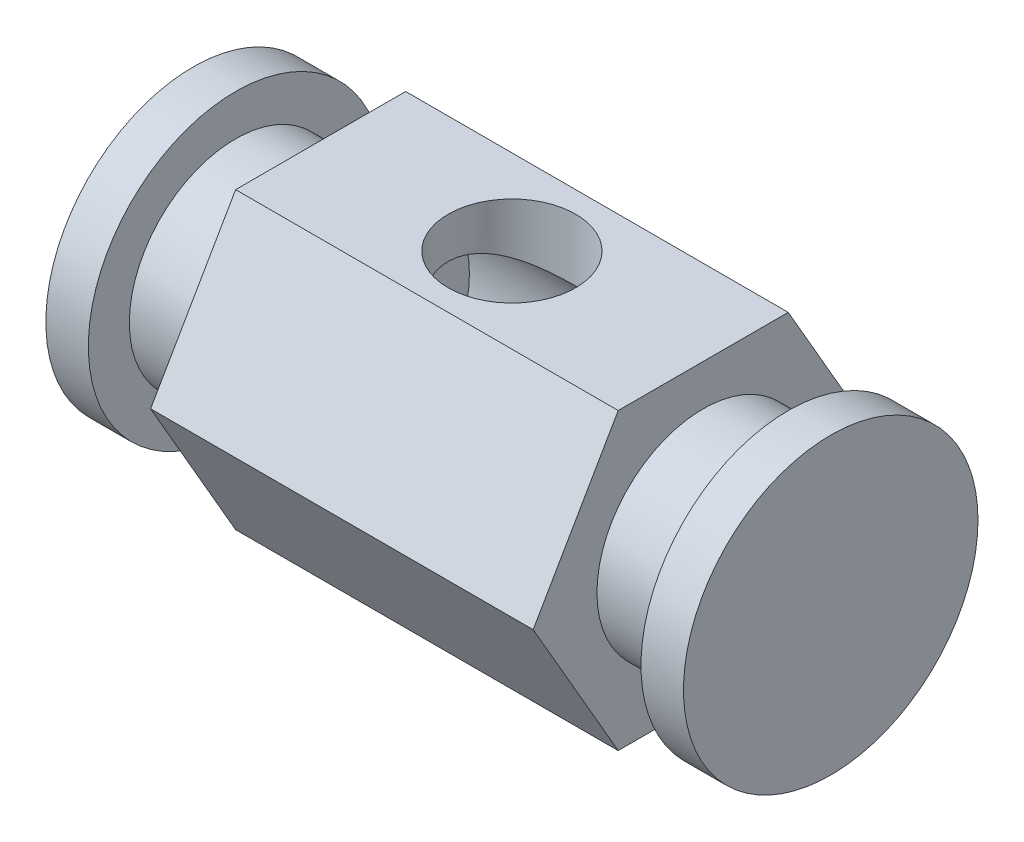
from build123d import *

# Parameters (mm, degrees)
SKETCH1_R               = 12.5
BOSS_EXTRUDE1_DEPTH     = 22.5
CUT_EXTRUDE2_DEPTH      = 35.731109974
CUT_EXTRUDE2_DEPTH_BACK = 35.731109974
SKETCH2_R               = 7.5
BOSS_EXTRUDE2_START     = -5
SKETCH3_R               = 12.5
BOSS_EXTRUDE2_DEPTH     = 15
SKETCH4_R               = 17.320508076
BOSS_EXTRUDE3_DEPTH     = 5


with BuildPart() as part:
    # Sketch1 → Boss-Extrude1 (new, symmetric)
    with BuildSketch(Plane(origin=(0, 0, 0), x_dir=(0, 0, -1), z_dir=(1, 0, 0))):
        Polygon((10, 17.320508076), (-10, 17.320508076), (-20, 0), (-10, -17.320508076), (10, -17.320508076), (20, 0), align=None)
        with Locations(Location((0, 0, 0), (0, 0, 180))):
            Circle(SKETCH1_R, mode=Mode.SUBTRACT)
    extrude(amount=BOSS_EXTRUDE1_DEPTH, both=True)

    # Sketch2 → Cut-Extrude2 (cut, two sides: drawn at the far end of the back side and taken through both)
    with BuildSketch(Plane(origin=(0, 0, 0), x_dir=(1, 0, 0), z_dir=(0, 1, 0)).offset(-CUT_EXTRUDE2_DEPTH_BACK)):
        with Locations(Location((0, 0, 0), (0, 0, 270))):
            Circle(SKETCH2_R)
    extrude(amount=CUT_EXTRUDE2_DEPTH + CUT_EXTRUDE2_DEPTH_BACK, mode=Mode.SUBTRACT)

    # Sketch3 → Boss-Extrude2 (add)
    with BuildSketch(Plane(origin=(22.5, 0, 0), x_dir=(0, 0, -1), z_dir=(1, 0, 0)).offset(BOSS_EXTRUDE2_START)):
        Circle(SKETCH3_R)
    boss_extrude2 = extrude(amount=BOSS_EXTRUDE2_DEPTH)

    # Sketch4 → Boss-Extrude3 (add)
    with BuildSketch(Plane(origin=(32.5, 0, 0), x_dir=(0, 0, -1), z_dir=(1, 0, 0))):
        Circle(SKETCH4_R)
    boss_extrude3 = extrude(amount=BOSS_EXTRUDE3_DEPTH)

    # Mirror3: Boss-Extrude2, Boss-Extrude3 across plane
    add(boss_extrude2.mirror(Plane(origin=(0, 0, 0), x_dir=(0, 0, 1), z_dir=(1, 0, 0))))
    add(boss_extrude3.mirror(Plane(origin=(0, 0, 0), x_dir=(0, 0, 1), z_dir=(1, 0, 0))))


solid = part.part
